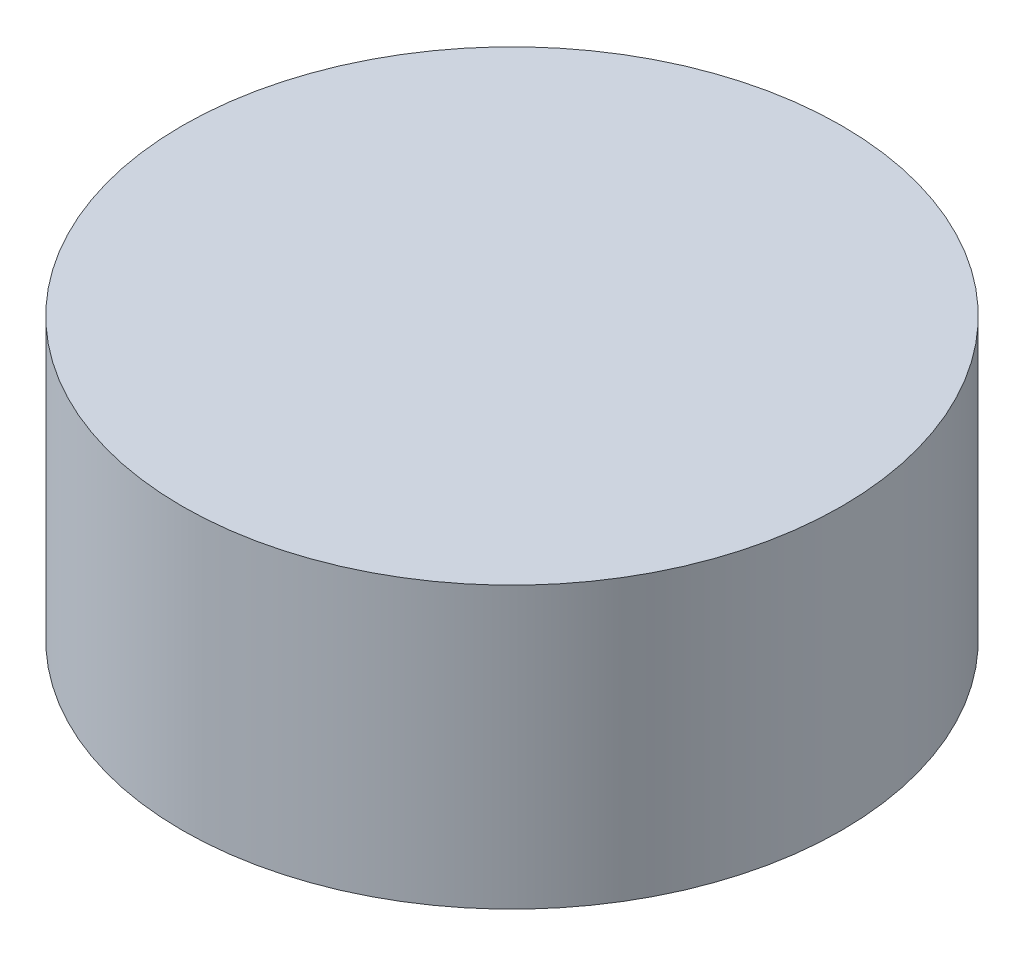
from build123d import *

# Parameters (mm, degrees)
SKETCH1_R           = 1.175
BOSS_EXTRUDE1_DEPTH = 1


with BuildPart() as part:
    # Sketch1 → Boss-Extrude1 (new body)
    with BuildSketch(Plane(origin=(0, 0, 0), x_dir=(1, 0, 0), z_dir=(0, 1, 0))):
        with Locations(Location((0, 0, 0), (0, 0, 270))):
            Circle(SKETCH1_R)
    extrude(amount=BOSS_EXTRUDE1_DEPTH)


solid = part.part
